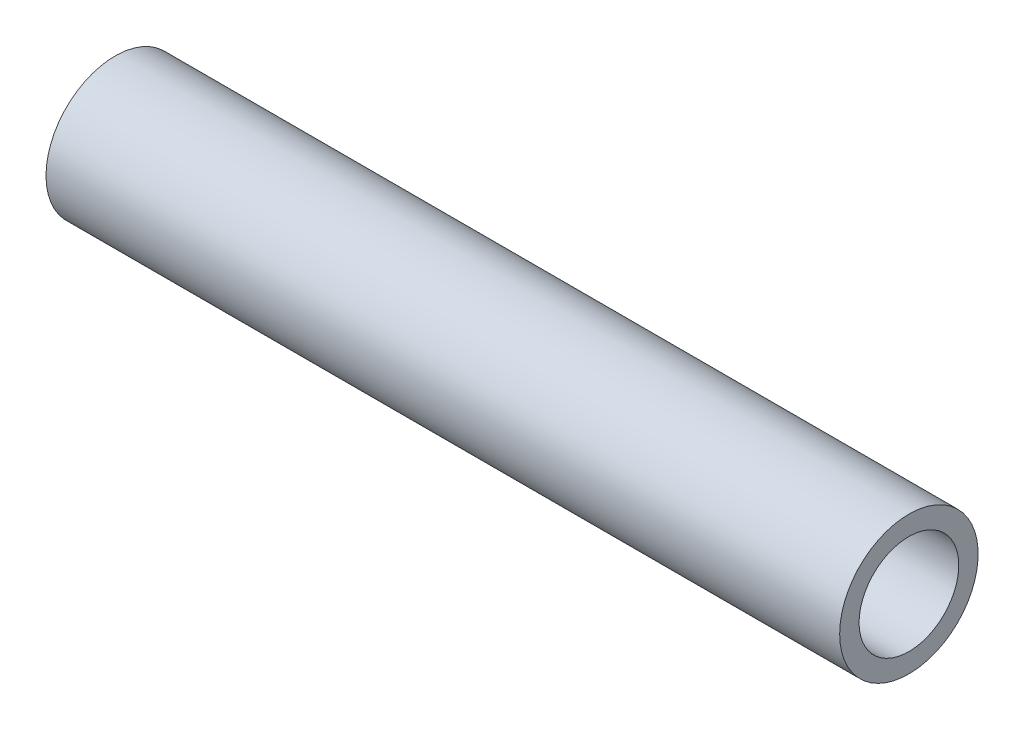
from build123d import *

# Parameters (mm, degrees)
TUBE_T4_STUB_SKETCH_W = 36.4
TUBE_T4_STUB_SKETCH_H = 0.889


with BuildPart() as part:
    # Tube_T4_Stub Sketch → Tube_T4_Stub (revolve)
    with BuildSketch(Plane.XY):
        with Locations((0, 2.7305)):
            Rectangle(TUBE_T4_STUB_SKETCH_W, TUBE_T4_STUB_SKETCH_H)
    revolve(axis=Axis((-1000, 0, 0), (1, 0, 0)))


solid = part.part
